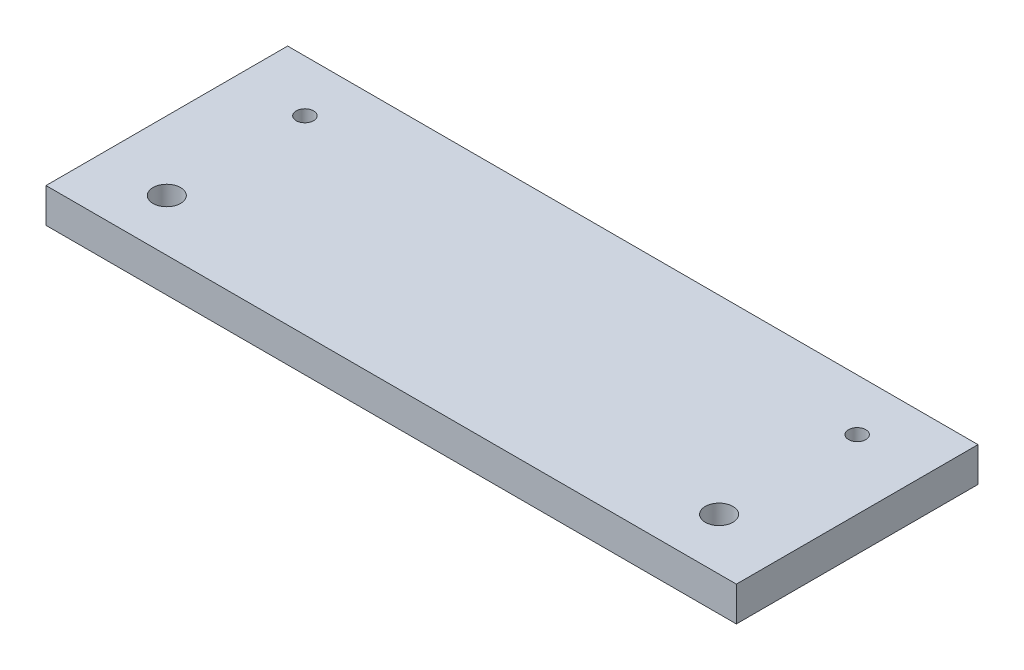
from build123d import *

# Parameters (mm, degrees)
SKETCH1_W           = 200
SKETCH1_H           = 70
BOSS_EXTRUDE1_DEPTH = 10
SKETCH2_R           = 4
CUT_EXTRUDE1_DEPTH  = 10
SKETCH4_R           = 2.5
CUT_EXTRUDE2_DEPTH  = 10


with BuildPart() as part:
    # Sketch1 → Boss-Extrude1 (new body)
    with BuildSketch(Plane(origin=(0, 0, 0), x_dir=(1, 0, 0), z_dir=(0, 1, 0))):
        Rectangle(SKETCH1_W, SKETCH1_H)
    extrude(amount=BOSS_EXTRUDE1_DEPTH)

    # Sketch2 → Cut-Extrude1 (cut)
    with BuildSketch(Plane(origin=(0, 10, 0), x_dir=(1, 0, 0), z_dir=(0, 1, 0))):
        with Locations(Location((-80, -20, 0), (0, 0, 270))):
            Circle(SKETCH2_R)
        with Locations(Location((80, -20, 0), (0, 0, 90))):
            Circle(SKETCH2_R)
    extrude(amount=-CUT_EXTRUDE1_DEPTH, mode=Mode.SUBTRACT)

    # Sketch4 → Cut-Extrude2 (cut)
    with BuildSketch(Plane(origin=(0, 10, 0), x_dir=(1, 0, 0), z_dir=(0, 1, 0))):
        with Locations(Location((-80, 20, 0), (0, 0, 270))):
            Circle(SKETCH4_R)
        with Locations(Location((80, 20, 0), (0, 0, 90))):
            Circle(SKETCH4_R)
    extrude(amount=-CUT_EXTRUDE2_DEPTH, mode=Mode.SUBTRACT)


solid = part.part
